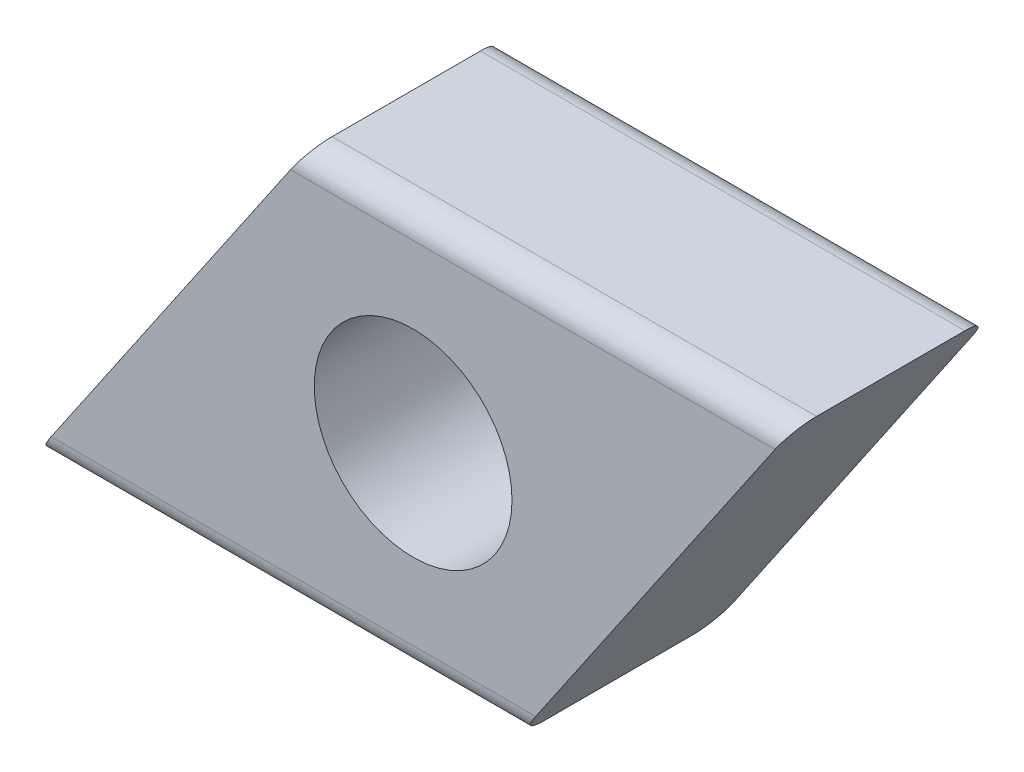
from build123d import *

# Parameters (mm, degrees)
EXTRUDE_1_DEPTH     = 4
SKETCH_2_R          = 2
CUT_EXTRUDE_1_DEPTH = 4
FILLET_1_R          = 0.5


with BuildPart() as part:
    # 草图1 → 凸台-拉伸1 (new body)
    with BuildSketch(Plane.XY):
        Polygon((0, 0), (9.8, 0), (15.321858536, 8.096238529), (5.521858536, 8.096238529), align=None)
    extrude(amount=EXTRUDE_1_DEPTH)

    # 草图2 → 切除-拉伸1 (cut)
    with BuildSketch(Plane.XY.offset(4)):
        with Locations((7.660929268, 4.048119264)):
            Circle(SKETCH_2_R)
    extrude(amount=-CUT_EXTRUDE_1_DEPTH, mode=Mode.SUBTRACT)

    # 圆角1
    fillet_1_edges = [part.edges().sort_by_distance(p)[0] for p in [
        (10.421858536, 8.096238529, 4),
        (10.421858536, 8.096238529, 0),
        (4.9, 0, 0),
        (4.9, 0, 4),
    ]]
    fillet(fillet_1_edges, radius=FILLET_1_R)


solid = part.part
